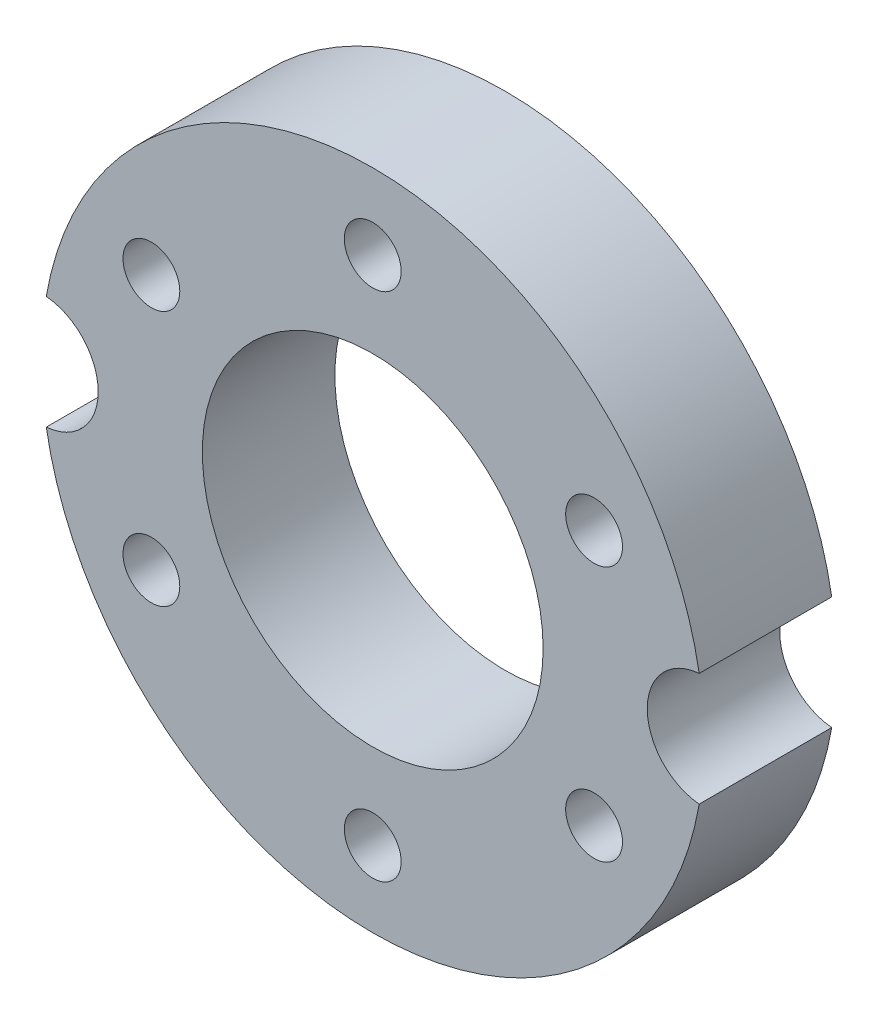
from build123d import *

# Parameters (mm, degrees)
SKETCH_1_R      = 1.5
SKETCH_1_R_2    = 9
EXTRUDE_1_DEPTH = 7


with BuildPart() as part:
    # 草图1 → 凸台-拉伸1 (new body)
    with BuildSketch(Plane.XY):
        with BuildLine():
            ThreePointArc((17.242857143, -2.988959276), (14.5, 0), (17.242857143, 2.988959276))
            ThreePointArc((17.242857143, 2.988959276), (0, 17.5), (-17.242857143, 2.988959276))
            ThreePointArc((-17.242857143, 2.988959276), (-14.5, 0), (-17.242857143, -2.988959276))
            ThreePointArc((-17.242857143, -2.988959276), (0, -17.5), (17.242857143, -2.988959276))
        make_face()
        with Locations((-11.691342951, -6.75)):
            Circle(SKETCH_1_R, mode=Mode.SUBTRACT)
        with Locations((0, -13.5)):
            Circle(SKETCH_1_R, mode=Mode.SUBTRACT)
        with Locations((11.691342951, -6.75)):
            Circle(SKETCH_1_R, mode=Mode.SUBTRACT)
        with Locations((-11.691342951, 6.75)):
            Circle(SKETCH_1_R, mode=Mode.SUBTRACT)
        Circle(SKETCH_1_R_2, mode=Mode.SUBTRACT)
        with Locations((11.691342951, 6.75)):
            Circle(SKETCH_1_R, mode=Mode.SUBTRACT)
        with Locations((0, 13.5)):
            Circle(SKETCH_1_R, mode=Mode.SUBTRACT)
    extrude(amount=EXTRUDE_1_DEPTH)


solid = part.part
